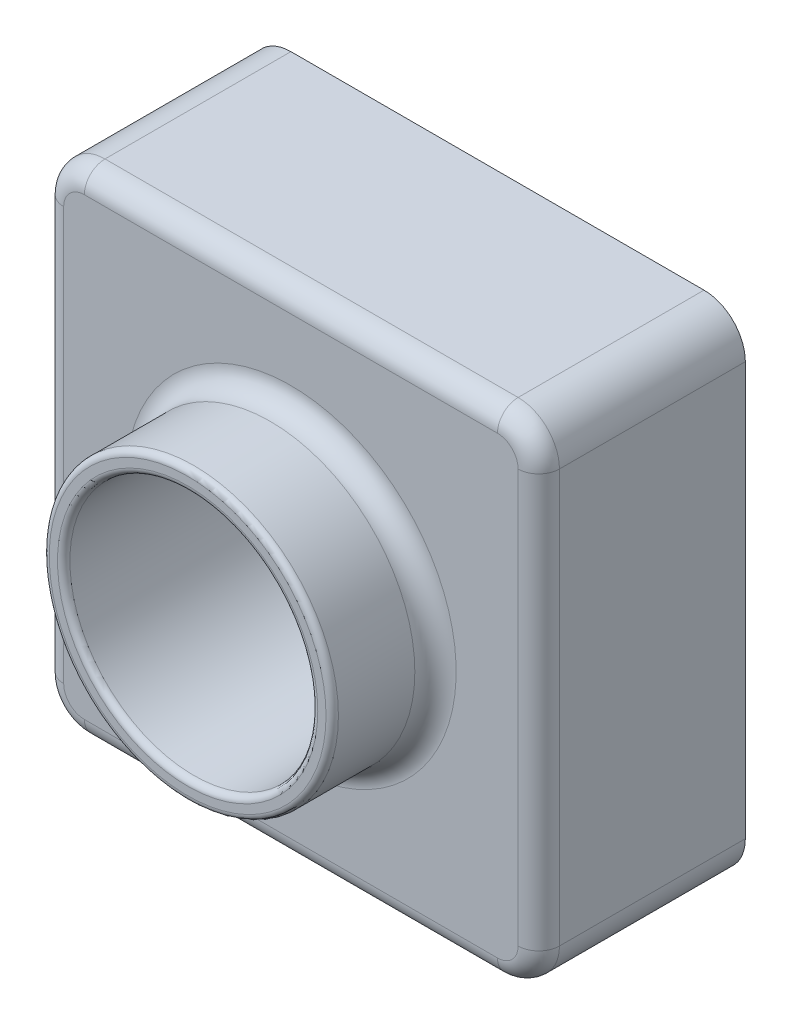
from build123d import *

# Parameters (mm, degrees)
SALIENTE_EXTRUIR1_DEPTH      = 50
VACIADO2_T                   = -2
SALIENTE_EXTRUIR3_DEPTH      = 25
SALIENTE_EXTRUIR3_DEPTH_BACK = 50
CROQUIS2_R                   = 35
CROQUIS2_R_2                 = 30
CROQUIS3_R                   = 30
CORTAR_EXTRUIR1_DEPTH        = 114.247516529
REDONDEO1_R                  = 1.5
REDONDEO2_R                  = 5
REDONDEO3_R                  = 5


with BuildPart() as part:
    # Croquis1 → Saliente-Extruir1 (new body)
    with BuildSketch(Plane.XY):
        with BuildLine():
            Line((-50, -60), (50, -60))
            ThreePointArc((50, -60), (57.071067812, -57.071067812), (60, -50))
            Line((60, -50), (60, 50))
            ThreePointArc((60, 50), (57.071067812, 57.071067812), (50, 60))
            Line((50, 60), (-50, 60))
            ThreePointArc((-50, 60), (-57.071067812, 57.071067812), (-60, 50))
            Line((-60, 50), (-60, -50))
            ThreePointArc((-60, -50), (-57.071067812, -57.071067812), (-50, -60))
        make_face()
    extrude(amount=SALIENTE_EXTRUIR1_DEPTH)

    # Vaciado2
    vaciado2_openings = [part.faces().sort_by_distance(p)[0] for p in [
        (0, 0, 0),
    ]]
    offset(amount=VACIADO2_T, openings=vaciado2_openings, kind=Kind.INTERSECTION)

    # Croquis2 → Saliente-Extruir3 (add, two sides: drawn at the far end of the back side and taken through both)
    with BuildSketch(Plane.XY.offset(50).offset(-SALIENTE_EXTRUIR3_DEPTH_BACK)):
        Circle(CROQUIS2_R)
        Circle(CROQUIS2_R_2, mode=Mode.SUBTRACT)
    extrude(amount=SALIENTE_EXTRUIR3_DEPTH + SALIENTE_EXTRUIR3_DEPTH_BACK)

    # Croquis3 → Cortar-Extruir1 (cut, through all)
    with BuildSketch(Plane.XY.offset(75)):
        Circle(CROQUIS3_R)
    extrude(amount=-CORTAR_EXTRUIR1_DEPTH, mode=Mode.SUBTRACT)

    # Redondeo1
    redondeo1_edges = [part.edges().sort_by_distance(p)[0] for p in [
        (-30, 0, 75),
        (-35, 0, 0),
        (-30, 0, 0),
        (-35, 0, 75),
    ]]
    fillet(redondeo1_edges, radius=REDONDEO1_R)

    # Redondeo2
    redondeo2_edges = [part.edges().sort_by_distance(p)[0] for p in [
        (-35, 0, 48),
        (-35, 0, 50),
    ]]
    fillet(redondeo2_edges, radius=REDONDEO2_R)

    # Redondeo3
    redondeo3_edges = [part.edges().sort_by_distance(p)[0] for p in [
        (57.071067812, -57.071067812, 50),
        (60, 0, 50),
        (57.071067812, 57.071067812, 50),
        (0, 60, 50),
        (-57.071067812, 57.071067812, 50),
        (-60, 0, 50),
        (-57.071067812, -57.071067812, 50),
        (0, -60, 50),
    ]]
    fillet(redondeo3_edges, radius=REDONDEO3_R)


solid = part.part
